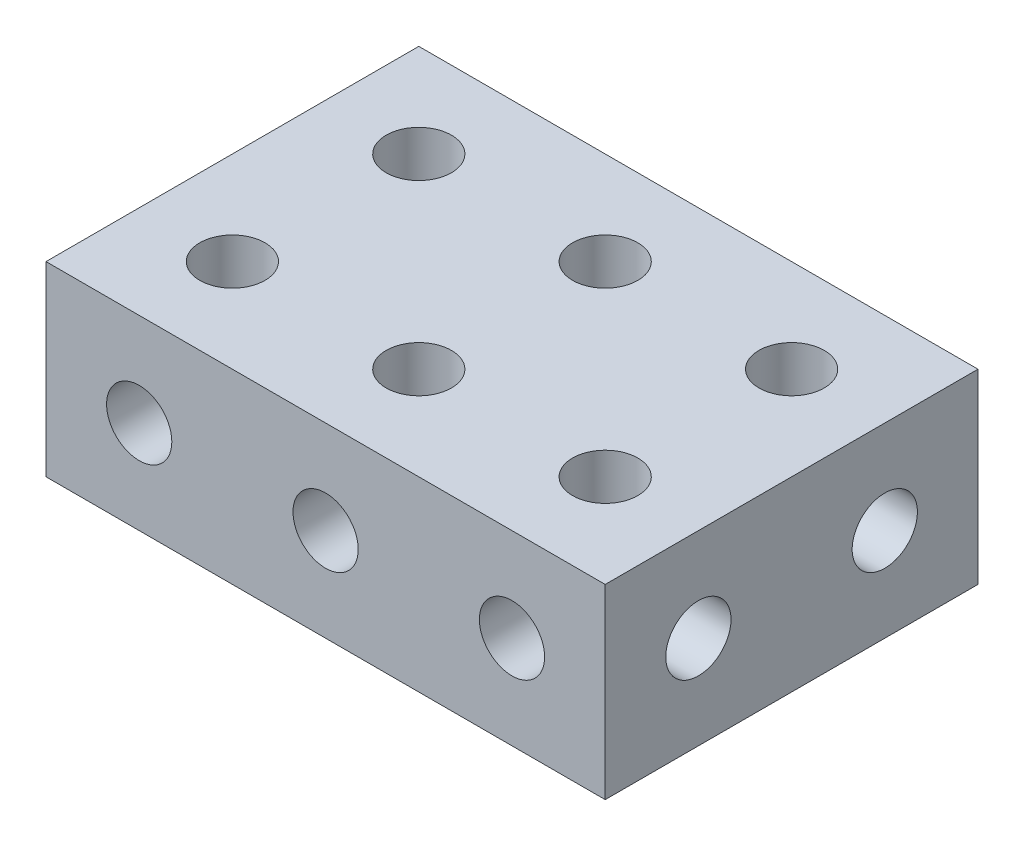
from build123d import *

# Parameters (mm, degrees)
ESQUISSE1_W             = 20
ESQUISSE1_H             = 10
BOSS_EXTRU_1_DEPTH      = 30
ESQUISSE2_R             = 1.75
ENL_V_MAT_EXTRU_1_DEPTH = 38.416573868
ESQUISSE3_R             = 1.75
ENL_V_MAT_EXTRU_2_DEPTH = 40
ESQUISSE4_R             = 1.75
ENL_V_MAT_EXTRU_3_DEPTH = 40


with BuildPart() as part:
    # Esquisse1 → Boss.-Extru.1 (new body)
    with BuildSketch(Plane(origin=(0, 0, 0), x_dir=(0, 0, -1), z_dir=(1, 0, 0))):
        with Locations((10, 5)):
            Rectangle(ESQUISSE1_W, ESQUISSE1_H)
    extrude(amount=BOSS_EXTRU_1_DEPTH)

    # Esquisse2 → Enlèv. mat.-Extru.1 (cut, through all)
    with BuildSketch(Plane(origin=(0, 10, 0), x_dir=(1, 0, 0), z_dir=(0, 1, 0))):
        with Locations(Location((5, 15, 0), (0, 0, 270))):
            Circle(ESQUISSE2_R)
        with Locations(Location((15, 15, 0), (0, 0, 270))):
            Circle(ESQUISSE2_R)
        with Locations(Location((25, 15, 0), (0, 0, 270))):
            Circle(ESQUISSE2_R)
        with Locations((35, 15)):
            Circle(ESQUISSE2_R)
        with Locations(Location((5, 5, 0), (0, 0, 270))):
            Circle(ESQUISSE2_R)
        with Locations(Location((15, 5, 0), (0, 0, 270))):
            Circle(ESQUISSE2_R)
        with Locations(Location((25, 5, 0), (0, 0, 270))):
            Circle(ESQUISSE2_R)
        with Locations((35, 5)):
            Circle(ESQUISSE2_R)
        with Locations((5, -5)):
            Circle(ESQUISSE2_R)
        with Locations((15, -5)):
            Circle(ESQUISSE2_R)
        with Locations((25, -5)):
            Circle(ESQUISSE2_R)
        with Locations((35, -5)):
            Circle(ESQUISSE2_R)
        with Locations((5, -15)):
            Circle(ESQUISSE2_R)
        with Locations((15, -15)):
            Circle(ESQUISSE2_R)
        with Locations((25, -15)):
            Circle(ESQUISSE2_R)
        with Locations((35, -15)):
            Circle(ESQUISSE2_R)
    extrude(amount=-ENL_V_MAT_EXTRU_1_DEPTH, mode=Mode.SUBTRACT)

    # Esquisse3 → Enlèv. mat.-Extru.2 (cut)
    with BuildSketch(Plane.XY):
        with Locations((5, 5)):
            Circle(ESQUISSE3_R)
        with Locations((15, 5)):
            Circle(ESQUISSE3_R)
        with Locations((25, 5)):
            Circle(ESQUISSE3_R)
        with Locations((35, 5)):
            Circle(ESQUISSE3_R)
    extrude(amount=-ENL_V_MAT_EXTRU_2_DEPTH, mode=Mode.SUBTRACT)

    # Esquisse4 → Enlèv. mat.-Extru.3 (cut)
    with BuildSketch(Plane(origin=(30, 0, 0), x_dir=(0, 0, -1), z_dir=(1, 0, 0))):
        with Locations((5, 5)):
            Circle(ESQUISSE4_R)
        with Locations(Location((15, 5, 0), (0, 0, 315))):
            Circle(ESQUISSE4_R)
        with Locations((25, 5)):
            Circle(ESQUISSE4_R)
        with Locations((35, 5)):
            Circle(ESQUISSE4_R)
    extrude(amount=-ENL_V_MAT_EXTRU_3_DEPTH, mode=Mode.SUBTRACT)


solid = part.part
